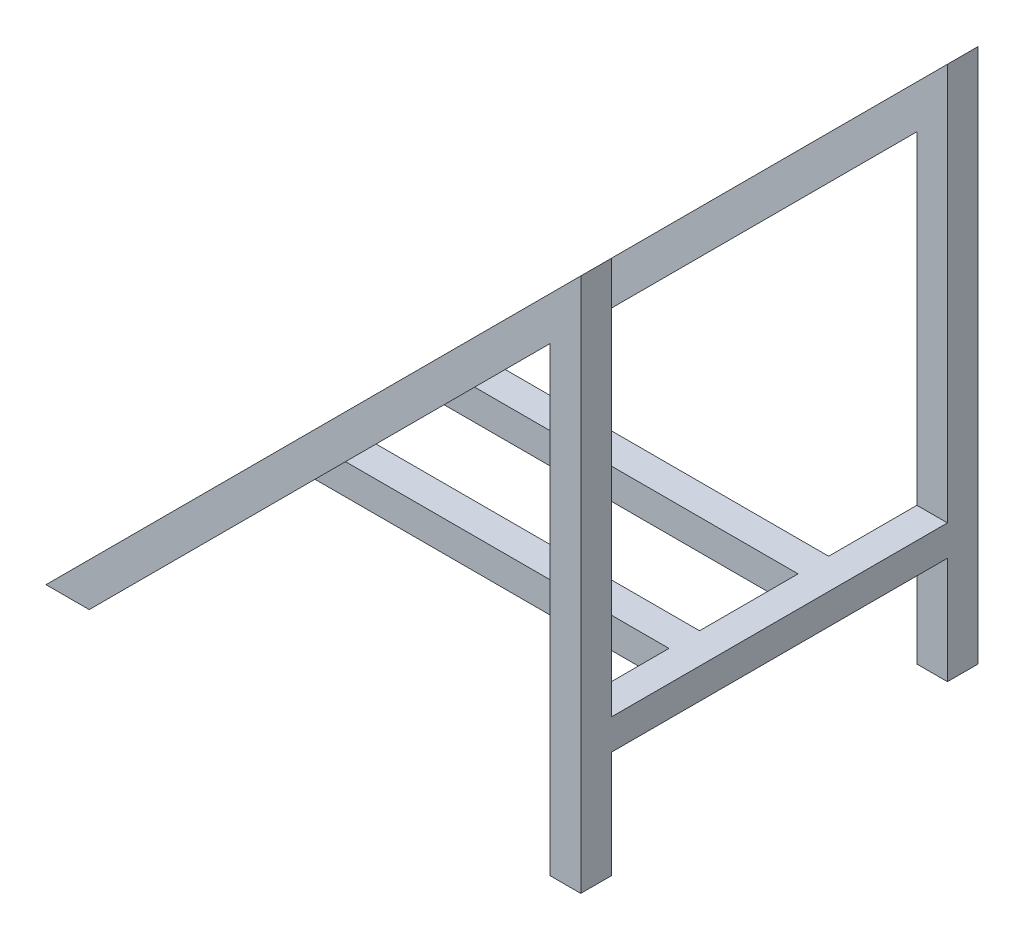
from build123d import *

# Parameters (mm, degrees)
BOSS_EXTRUDE1_DEPTH = 20
SKETCH2_W           = 20
SKETCH2_H           = 20
BOSS_EXTRUDE2_DEPTH = 220
BOSS_EXTRUDE3_DEPTH = 20
LPATTERN1_COUNT     = 2
LPATTERN1_PITCH     = 84.5


with BuildPart() as part:
    # Sketch1 → Boss-Extrude1 (new body)
    with BuildSketch(Plane.XY):
        Polygon((0, 0), (350, 350), (350, 0), (330, 0), (330, 301.715728753), (28.284271247, 0), align=None)
    boss_extrude1 = extrude(amount=BOSS_EXTRUDE1_DEPTH)

    # Sketch2 → Boss-Extrude2 (add)
    with BuildSketch(Plane.XY.offset(20)):
        with Locations((340, 80)):
            Rectangle(SKETCH2_W, SKETCH2_H)
        Polygon((98.284271247, 70), (112.426406871, 84.142135624), (98.284271247, 98.284271247), (84.142135624, 84.142135624), align=None)
    extrude(amount=BOSS_EXTRUDE2_DEPTH)

    # Mirror1: Boss-Extrude1 across plane
    add(boss_extrude1.mirror(Plane(origin=(0, 0, 130), x_dir=(1, 0, 0), z_dir=(0, 0, -1))))

    # Sketch5 → Boss-Extrude3 (add)
    with BuildSketch(Plane.XY.offset(182.25)):
        Polygon((330, 70), (98.284271247, 70), (118.284271247, 90), (330, 90), align=None)
    boss_extrude3 = extrude(amount=-BOSS_EXTRUDE3_DEPTH)

    # LPattern1: Boss-Extrude3 ×2
    with Locations(*[(0, 0, -i * LPATTERN1_PITCH) for i in range(1, LPATTERN1_COUNT)]):
        add(boss_extrude3)


solid = part.part
